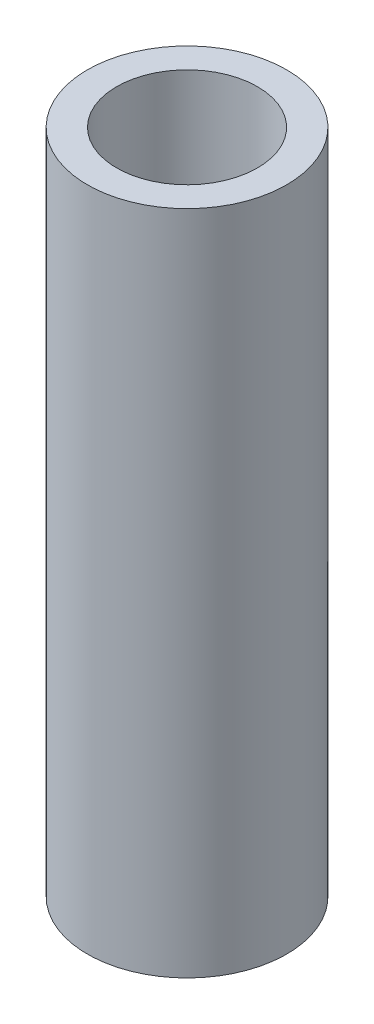
from build123d import *

# Parameters (mm, degrees)
SKETCH1_R           = 8.525
SKETCH1_R_2         = 6.025
EXTRUDE_THIN1_DEPTH = 57


with BuildPart() as part:
    # Sketch1 → Extrude-Thin1 (new body)
    with BuildSketch(Plane(origin=(0, 0, 0), x_dir=(1, 0, 0), z_dir=(0, 1, 0))):
        Circle(SKETCH1_R)
        Circle(SKETCH1_R_2, mode=Mode.SUBTRACT)
    extrude(amount=EXTRUDE_THIN1_DEPTH)


solid = part.part
